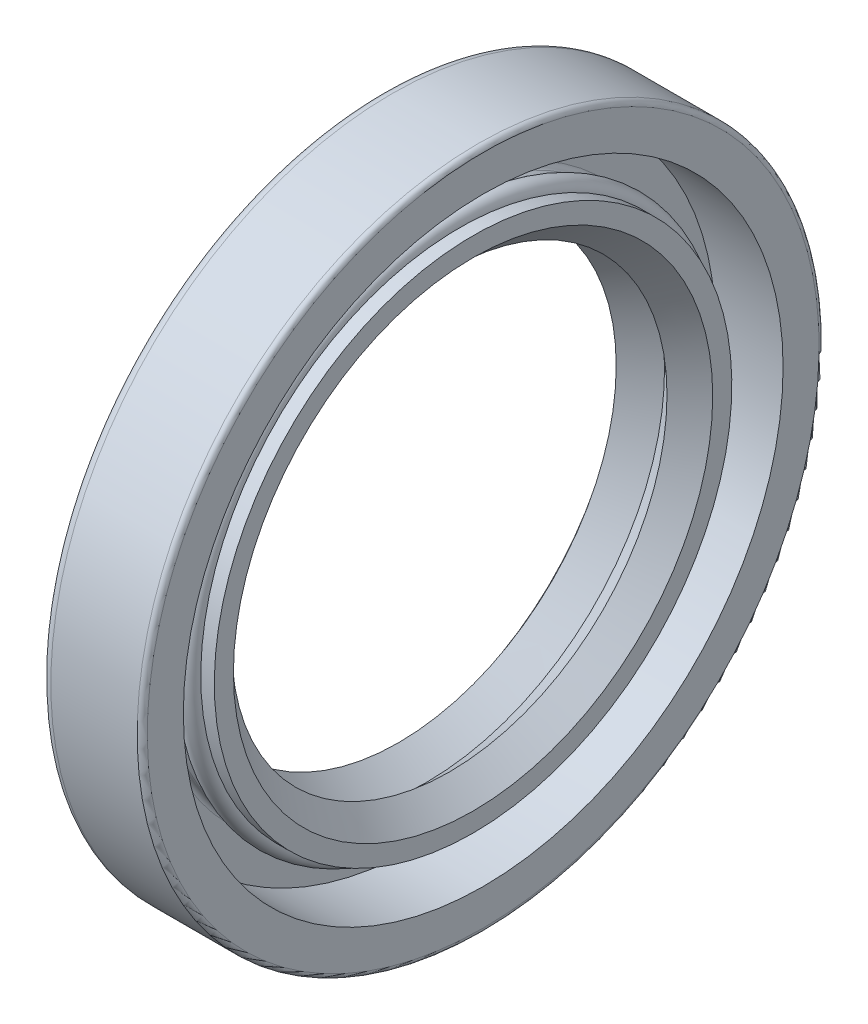
from build123d import *

# Parameters (mm, degrees)
SKETCH2_R = 0.7


with BuildPart() as part:
    # Sketch1 → Revolve1 (revolve)
    with BuildSketch(Plane.XY, mode=Mode.PRIVATE) as revolve1_sk:
        with BuildLine():
            Line((0, 20.666666667), (0.21875, 20.666666667))
            Line((0.21875, 20.666666667), (0.21875, 17.833333333))
            Line((0.21875, 17.833333333), (0, 17.833333333))
            Line((0, 17.833333333), (0, 17.125))
            Line((0, 17.125), (1.166666667, 16.416666667))
            Line((1.166666667, 16.416666667), (0.489140143, 15.914958407))
            Line((0.489140143, 15.914958407), (1.166666667, 15))
            Line((1.166666667, 15), (3.07978893, 16.416666667))
            Line((3.07978893, 16.416666667), (4.666666667, 15))
            Line((4.666666667, 15), (6.3, 16.516666667))
            Line((6.3, 16.516666667), (6.3, 17.833333333))
            Line((6.3, 17.833333333), (5.366666667, 17.833333333))
            ThreePointArc((5.366666667, 17.833333333), (4.666666667, 17.133333333), (3.966666667, 17.833333333))
            Line((3.966666667, 17.833333333), (2.683333333, 17.833333333))
            ThreePointArc((2.683333333, 17.833333333), (2.43584596, 17.93584596), (2.333333333, 18.183333333))
            Line((2.333333333, 18.183333333), (2.333333333, 20.666666667))
            Line((2.333333333, 20.666666667), (7, 20.666666667))
            Line((7, 20.666666667), (7, 23.15))
            ThreePointArc((7, 23.15), (6.897487373, 23.397487373), (6.65, 23.5))
            Line((6.65, 23.5), (0.7, 23.5))
            ThreePointArc((0.7, 23.5), (0.205025253, 23.294974747), (0, 22.8))
            Line((0, 22.8), (0, 20.666666667))
        make_face()
    revolve(revolve1_sk.sketch.rotate(Axis((7, 0, 0), (-1, 0, 0)), 180), axis=Axis((7, 0, 0), (-1, 0, 0)))


with BuildPart() as body_2:
    # Sketch2 → Revolve2 (revolve)
    with BuildSketch(Plane.XY, mode=Mode.PRIVATE) as revolve2_sk:
        with Locations((4.666666667, 17.833333333)):
            Circle(SKETCH2_R)
    revolve(revolve2_sk.sketch.rotate(Axis((0, 0, 0), (1, 0, 0)), 90), axis=Axis((0, 0, 0), (1, 0, 0)))


solid = Compound([part.part, body_2.part])
